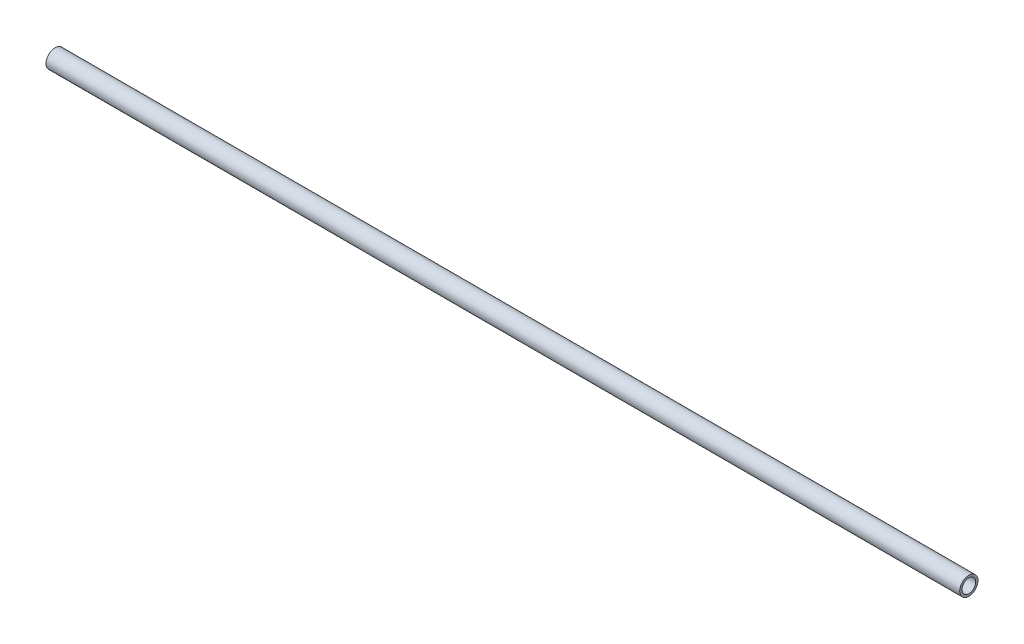
from build123d import *

# Parameters (mm, degrees)
SKETCH1_R           = 2
SKETCH1_R_2         = 1.5
BOSS_EXTRUDE1_DEPTH = 200


with BuildPart() as part:
    # Sketch1 → Boss-Extrude1 (new body)
    with BuildSketch(Plane(origin=(0, 0, 0), x_dir=(0, 0, -1), z_dir=(1, 0, 0))):
        Circle(SKETCH1_R)
        Circle(SKETCH1_R_2, mode=Mode.SUBTRACT)
    extrude(amount=BOSS_EXTRUDE1_DEPTH)


solid = part.part
